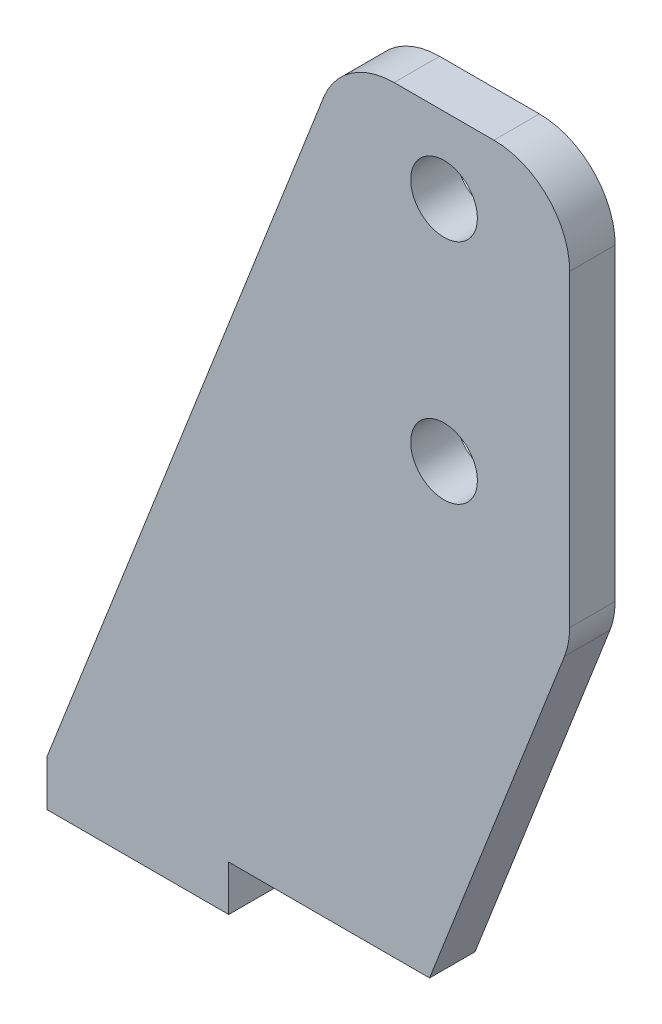
from build123d import *

# Parameters (mm, degrees)
SKETCH1_R           = 2.2
BOSS_EXTRUDE1_DEPTH = 3


with BuildPart() as part:
    # Sketch1 → Boss-Extrude1 (new body)
    with BuildSketch(Plane.XY):
        with BuildLine():
            Line((18.258523289, 46.816726382), (0, 0))
            Line((0, 0), (0, -3))
            Line((0, -3), (12, -3))
            Line((12, -3), (12, 0))
            Line((12, 0), (25.254184663, 0))
            Line((25.254184663, 0), (34.158272776, 22.830995159))
            ThreePointArc((34.158272776, 22.830995159), (34.413825591, 23.723428265), (34.5, 24.647721542))
            Line((34.5, 24.647721542), (34.5, 45))
            ThreePointArc((34.5, 45), (33.035533906, 48.535533906), (29.5, 50))
            Line((29.5, 50), (22.916796065, 50))
            ThreePointArc((22.916796065, 50), (20.095770711, 49.128173441), (18.258523289, 46.816726382))
        make_face()
        with Locations((26.208398032, 30)):
            Circle(SKETCH1_R, mode=Mode.SUBTRACT)
        with Locations((26.208398032, 45)):
            Circle(SKETCH1_R, mode=Mode.SUBTRACT)
    extrude(amount=BOSS_EXTRUDE1_DEPTH)


solid = part.part
